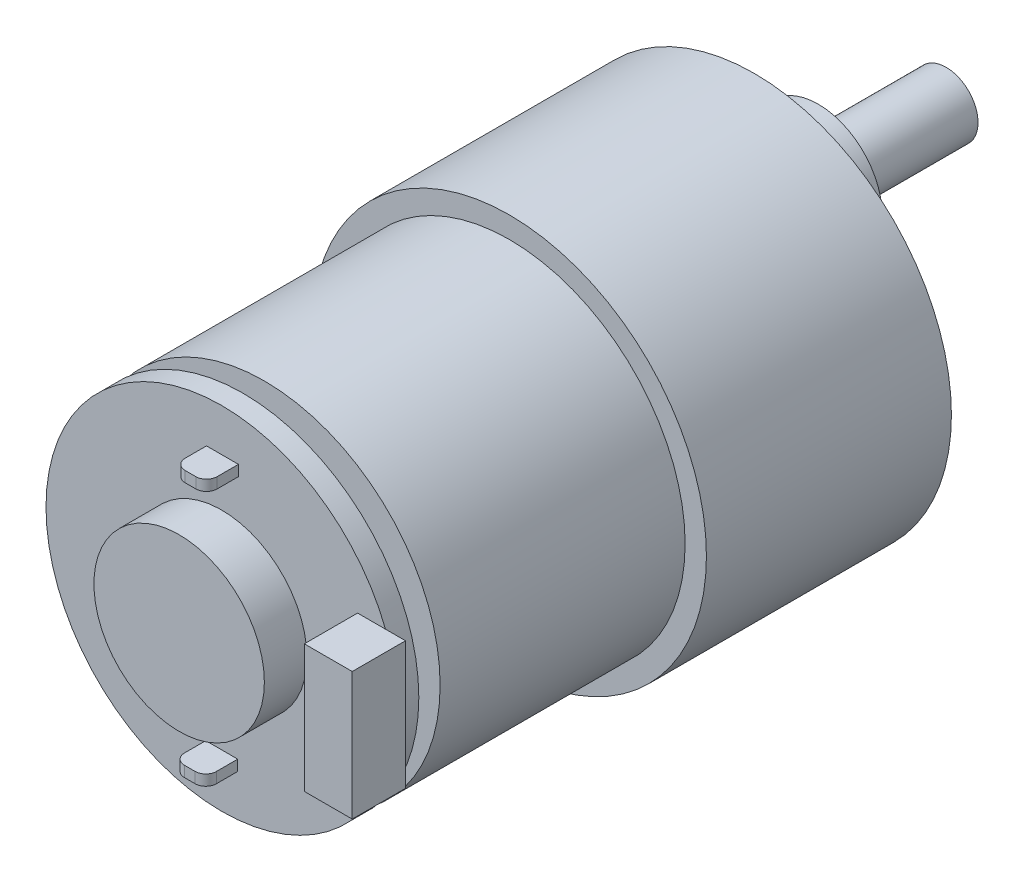
from build123d import *

# Parameters (mm, degrees)
SKETCH_1_R       = 18.5
EXTRUDE_3_DEPTH  = 23
SKETCH_3_R       = 16.5
EXTRUDE_4_DEPTH  = 23
SKETCH_4_R       = 6
EXTRUDE_5_DEPTH  = 6
SKETCH_6_R       = 3
EXTRUDE_6_DEPTH  = 12
SKETCH_7_R       = 2
EXTRUDE_7_DEPTH  = 2
SKETCH_8_W       = 3
SKETCH_8_H       = 1
EXTRUDE_8_DEPTH  = 7
SKETCH_9_R       = 16.5
EXTRUDE_9_DEPTH  = 2
SKETCH_10_W      = 4.5
SKETCH_10_H      = 12
EXTRUDE_10_DEPTH = 5
FILLET_1_R       = 1
SKETCH_11_R      = 8
EXTRUDE_11_DEPTH = 4


with BuildPart() as part:
    # 草图1 → 凸台-拉伸3 (new body)
    with BuildSketch(Plane.XY):
        Circle(SKETCH_1_R)
    extrude(amount=EXTRUDE_3_DEPTH)

    # 草图3 → 凸台-拉伸4 (add)
    with BuildSketch(Plane.XY.offset(23)):
        Circle(SKETCH_3_R)
    extrude(amount=EXTRUDE_4_DEPTH)

    # 草图4 → 凸台-拉伸5 (add)
    with BuildSketch(Plane(origin=(0, 0, 0), x_dir=(-1, 0, 0), z_dir=(0, 0, -1))):
        with Locations(Location((0, 7, 0), (0, 0, 180))):
            Circle(SKETCH_4_R)
    extrude(amount=EXTRUDE_5_DEPTH)

    # 草图6 → 凸台-拉伸6 (add)
    with BuildSketch(Plane(origin=(0, 0, -6), x_dir=(-1, 0, 0), z_dir=(0, 0, -1))):
        with Locations((0, 7)):
            Circle(SKETCH_6_R)
    extrude(amount=EXTRUDE_6_DEPTH)

    # 草图7 → 凸台-拉伸7 (add)
    with BuildSketch(Plane.XY.offset(46)):
        Circle(SKETCH_7_R)
    extrude(amount=EXTRUDE_7_DEPTH)

    # 草图8 → 凸台-拉伸8 (add)
    with BuildSketch(Plane.XY.offset(46)):
        with Locations((0, -12)):
            Rectangle(SKETCH_8_W, SKETCH_8_H)
        with Locations((0.066509227, 12)):
            Rectangle(SKETCH_8_W, SKETCH_8_H)
    extrude(amount=EXTRUDE_8_DEPTH)

    # 草图9 → 凸台-拉伸9 (add)
    with BuildSketch(Plane.XY.offset(48)):
        Circle(SKETCH_9_R)
    extrude(amount=EXTRUDE_9_DEPTH)

    # 草图10 → 凸台-拉伸10 (add)
    with BuildSketch(Plane.XY.offset(50)):
        with Locations((15, 0)):
            Rectangle(SKETCH_10_W, SKETCH_10_H)
    extrude(amount=EXTRUDE_10_DEPTH)

    # 圆角1
    fillet_1_edges = [part.edges().sort_by_distance(p)[0] for p in [
        (1.566509227, 12, 53),
        (-1.433490773, 12, 53),
        (1.5, -12, 53),
        (-1.5, -12, 53),
    ]]
    fillet(fillet_1_edges, radius=FILLET_1_R)

    # 草图11 → 凸台-拉伸11 (add)
    with BuildSketch(Plane.XY.offset(50)):
        Circle(SKETCH_11_R)
    extrude(amount=EXTRUDE_11_DEPTH)


solid = part.part
